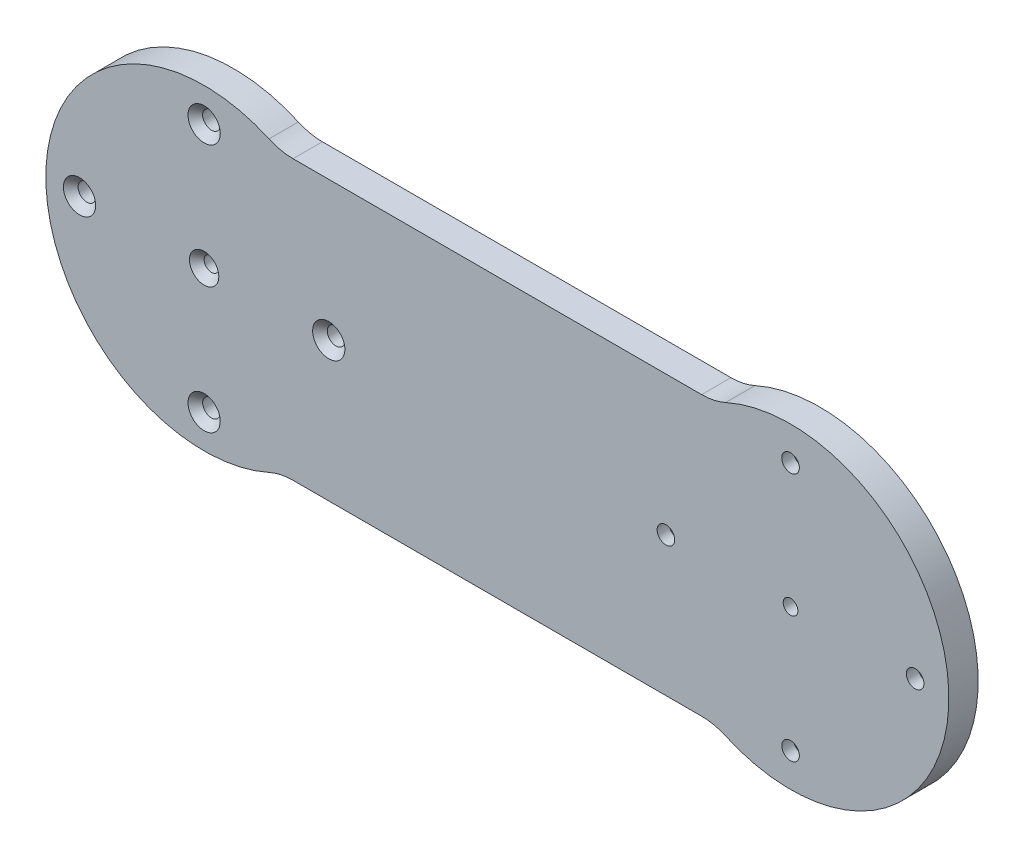
from build123d import *

# Parameters (mm, degrees)
EXTRUDE_1_DEPTH     = 10
FILLET_1_R          = 20
SKETCH_2_R          = 3
SKETCH_2_R_2        = 2.5
CUT_EXTRUDE_1_DEPTH = 10
SKETCH_3_R          = 5.5
SKETCH_3_R_2        = 5
CUT_EXTRUDE_2_DEPTH = 6
SKETCH_4_R          = 2.5
CUT_EXTRUDE_3_DEPTH = 10
SKETCH_5_R          = 3
CUT_EXTRUDE_4_DEPTH = 10
CHAMFER_1_SIZE      = 2.5


with BuildPart() as part:
    # Эскиз1 → Бобышка-Вытянуть1 (new body)
    with BuildSketch(Plane.XY):
        with BuildLine():
            Line((-49.694865317, 47.5), (98.933936526, 47.5))
            ThreePointArc((98.933936526, 47.5), (178.619535605, 0), (98.933936526, -47.5))
            Line((98.933936526, -47.5), (-49.694865317, -47.5))
            ThreePointArc((-49.694865317, -47.5), (-129.380464395, 0), (-49.694865317, 47.5))
        make_face()
    extrude(amount=EXTRUDE_1_DEPTH)

    # Скругление1
    fillet_1_edges = [part.edges().sort_by_distance(p)[0] for p in [
        (-49.694865317, 47.5, 5),
        (98.933936526, 47.5, 5),
        (98.933936526, -47.5, 5),
        (-49.694865317, -47.5, 5),
    ]]
    fillet(fillet_1_edges, radius=FILLET_1_R)

    # Эскиз2 → Вырез-Вытянуть1 (cut)
    with BuildSketch(Plane(origin=(0, 0, 0), x_dir=(-1, 0, 0), z_dir=(0, 0, -1))):
        with Locations((-124.619535605, 42.5)):
            Circle(SKETCH_2_R)
        with Locations((-124.619535605, -42.5)):
            Circle(SKETCH_2_R)
        with Locations((-82.119535605, 0)):
            Circle(SKETCH_2_R)
        with Locations((-167.119535605, 0)):
            Circle(SKETCH_2_R)
        with Locations((-124.619535605, 0)):
            Circle(SKETCH_2_R_2)
    extrude(amount=-CUT_EXTRUDE_1_DEPTH, mode=Mode.SUBTRACT)

    # Эскиз3 → Вырез-Вытянуть2 (cut)
    with BuildSketch(Plane(origin=(0, 0, 0), x_dir=(-1, 0, 0), z_dir=(0, 0, -1))):
        with Locations((-124.619535605, 42.5)):
            Circle(SKETCH_3_R)
        with Locations((-167.119535605, 0)):
            Circle(SKETCH_3_R)
        with Locations((-124.619535605, -42.5)):
            Circle(SKETCH_3_R)
        with Locations((-82.119535605, 0)):
            Circle(SKETCH_3_R)
        with Locations((-124.619535605, 0)):
            Circle(SKETCH_3_R_2)
    extrude(amount=-CUT_EXTRUDE_2_DEPTH, mode=Mode.SUBTRACT)

    # Эскиз4 → Вырез-Вытянуть3 (cut)
    with BuildSketch(Plane(origin=(0, 0, 0), x_dir=(-1, 0, 0), z_dir=(0, 0, -1))):
        with Locations((75.380464395, 0)):
            Circle(SKETCH_4_R)
    extrude(amount=-CUT_EXTRUDE_3_DEPTH, mode=Mode.SUBTRACT)

    # Эскиз5 → Вырез-Вытянуть4 (cut)
    with BuildSketch(Plane(origin=(0, 0, 0), x_dir=(-1, 0, 0), z_dir=(0, 0, -1))):
        with Locations((75.380464395, 42.5)):
            Circle(SKETCH_5_R)
        with Locations((75.380464395, -42.5)):
            Circle(SKETCH_5_R)
        with Locations((32.880464395, 0)):
            Circle(SKETCH_5_R)
        with Locations((117.880464395, 0)):
            Circle(SKETCH_5_R)
    extrude(amount=-CUT_EXTRUDE_4_DEPTH, mode=Mode.SUBTRACT)

    # Фаска1
    chamfer_1_edges = [part.edges().sort_by_distance(p)[0] for p in [
        (-72.380464395, -42.5, 10),
        (-29.880464395, 0, 10),
        (-114.880464395, 0, 10),
        (-72.880464395, 0, 10),
        (-72.380464395, 42.5, 10),
    ]]
    chamfer(chamfer_1_edges, length=CHAMFER_1_SIZE)


solid = part.part
